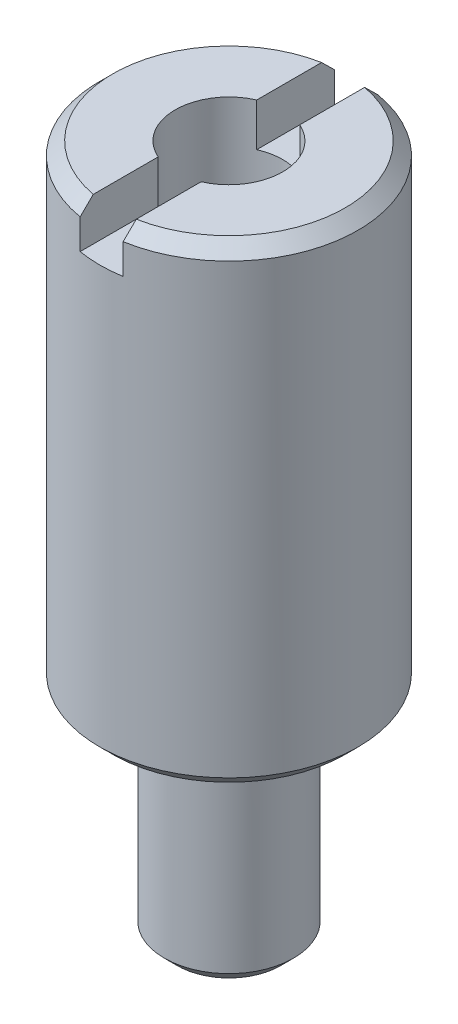
from build123d import *

# Parameters (mm, degrees)
CHAMFER_1_SIZE         = 0.3
CUT_EXTRUDE_2_DEPTH    = 1
HOLE_WIZARD_M3_1_D     = 2.5
HOLE_WIZARD_M3_1_DEPTH = 8.5
HOLE_WIZARD_M3_1_TIP   = 0.751075774


with BuildPart() as part:
    # ｽｹｯﾁ1 → 回転1 (revolve)
    with BuildSketch(Plane.XY):
        Polygon((0, -5), (-1.5, -5), (-1.5, 0), (-3, 0), (-3, 11), (0, 11), align=None)
    revolve(axis=Axis((0, 16.004822162, 0), (0, -1, 0)))

    # 面取り1
    chamfer_1_edges = [part.edges().sort_by_distance(p)[0] for p in [
        (3, 11, 0),
        (3, 0, 0),
        (1.5, -5, 0),
    ]]
    chamfer(chamfer_1_edges, length=CHAMFER_1_SIZE)

    # ｽｹｯﾁ2 → ｶｯﾄ - 押し出し2 (cut)
    with BuildSketch(Plane(origin=(0, 11, 0), x_dir=(1, 0, 0), z_dir=(0, 1, 0))):
        with BuildLine():
            Line((0.5, -2.958039892), (0.5, 2.958039892))
            ThreePointArc((0.5, 2.958039892), (0, 3), (-0.5, 2.958039892))
            Line((-0.5, 2.958039892), (-0.5, -2.958039892))
            ThreePointArc((-0.5, -2.958039892), (0, -3), (0.5, -2.958039892))
        make_face()
    extrude(amount=-CUT_EXTRUDE_2_DEPTH, mode=Mode.SUBTRACT)

    # M3 ねじ穴1
    with Locations(Plane(origin=(0, 11, 0), x_dir=(1, 0, 0), z_dir=(0, 1, 0))):
        with Locations((0, 0)):
            Hole(HOLE_WIZARD_M3_1_D / 2, depth=HOLE_WIZARD_M3_1_DEPTH)
            with Locations((0, 0, -(HOLE_WIZARD_M3_1_DEPTH + HOLE_WIZARD_M3_1_TIP / 2))):  # 118° drill point
                Cone(0, HOLE_WIZARD_M3_1_D / 2, HOLE_WIZARD_M3_1_TIP, mode=Mode.SUBTRACT)


solid = part.part
